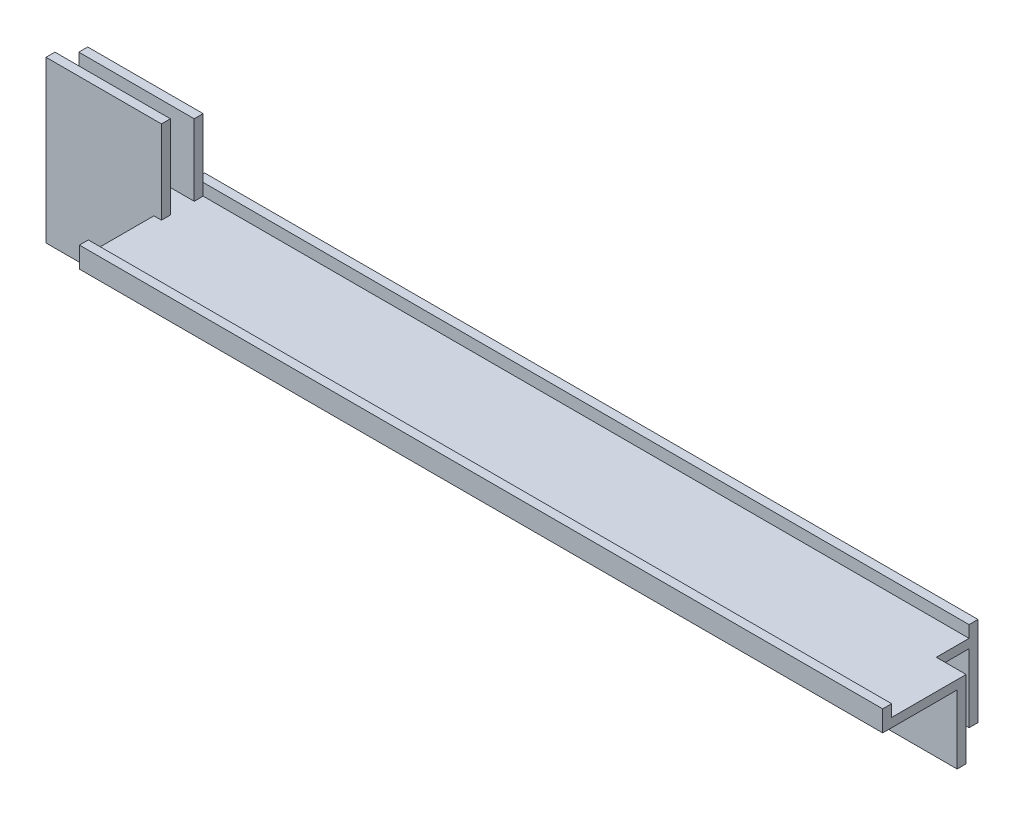
from build123d import *

# Parameters (mm, degrees)
SKETCH1_W                = 1.5
SKETCH1_H                = 2
BOSS_EXTRUDE1_DEPTH      = 259.69214
RIGHT_EAR_DEPTH          = 1.27
RIGHT_EAR_DEPTH_BACK     = 24.45893
SKETCH9_W                = 1.5
SKETCH9_H                = 11.5
LEFT_EAR_DEPTH           = 18.10893
LEFT_EAR_DEPTH_BACK      = 1.27
CUT_EXTRUDE6_DEPTH       = 280.89897194
CUT_EXTRUDE6_DEPTH_BACK  = 280.89897194
SURFACE_EXTRUDE1_1_BACK  = 307.34
SURFACE_EXTRUDE1_1_DEPTH = 308.93893
SURFACE_EXTRUDE1_2_BACK  = 307.34
SURFACE_EXTRUDE1_2_DEPTH = 308.93893
CUT_EXTRUDE7_DEPTH       = 157.732995968


with BuildPart() as part:
    # Sketch1 → Boss-Extrude1 (new body)
    with BuildSketch(Plane(origin=(0, 0, 0), x_dir=(0, 0, -1), z_dir=(1, 0, 0))):
        Polygon((-21, 0), (0, 0), (0, -13), (-1.5, -13), (-1.5, -1.5), (-7, -1.5), (-7, -13), (-8.5, -13), (-8.5, -1.5), (-21, -1.5), align=None)
        with Locations((-20.25, 1)):
            Rectangle(SKETCH1_W, SKETCH1_H)
        with Locations((-0.75, 1)):
            Rectangle(SKETCH1_W, SKETCH1_H)
    extrude(amount=-BOSS_EXTRUDE1_DEPTH)


with BuildPart() as body_2:
    # Mirror3: mirrored copy
    add(part.part.mirror(Plane.ZX.offset(7)))


with BuildPart() as part_1:
    add(part.part)

    add(body_2.part)  # right_ear merges body 2
    # Sketch9 → right_ear (add, two sides: drawn at the far end of the back side and taken through both)
    with BuildSketch(Plane.ZY.offset(-RIGHT_EAR_DEPTH_BACK)):
        with Locations((7.75, -7.25)):
            Rectangle(SKETCH9_W, SKETCH9_H)
        Polygon((1.5, -1.5), (7, -1.5), (8.5, -1.5), (8.5, 15.5), (7, 15.5), (1.5, 15.5), align=None)
        with Locations((7.75, 21.25)):
            Rectangle(SKETCH9_W, SKETCH9_H)
    extrude(amount=RIGHT_EAR_DEPTH + RIGHT_EAR_DEPTH_BACK)

    # Sketch12 → left_ear (add, two sides: drawn at the far end of the back side and taken through both)
    with BuildSketch(Plane.ZY.offset(259.69214).offset(-LEFT_EAR_DEPTH_BACK)):
        Polygon((8.5, -13), (8.5, 27), (7, 27), (7, 15.5), (1.5, 15.5), (1.5, -1.5), (7, -1.5), (7, -13), align=None)
    extrude(amount=LEFT_EAR_DEPTH + LEFT_EAR_DEPTH_BACK)

    # Sketch10<3> → Cut-Extrude6 (cut, two sides: drawn at the far end of the back side and taken through both)
    with BuildSketch(Plane(origin=(0, 0, 0), x_dir=(1, 0, 0), z_dir=(0, 1, 0)).offset(-CUT_EXTRUDE6_DEPTH_BACK)):
        Polygon((-1.27, -1.5), (-129.84607, -1.5), (-129.84607, -7), (-124.84607, -7), (-124.84607, -19.5), (0, -19.5), (0, -8.5), (-1.27, -8.5), align=None)
        Polygon((-129.84607, 5.228694749), (-129.84607, 0), (-129.84607, -1.5), (-1.27, -1.5), (-1.27, -8.5), (0, -8.5), (0, -19.5), (-124.84607, -19.5), (-124.84607, -21), (-124.84607, -30.387985995), (75.346094687, -30.387985995), (75.346094687, 5.228694749), align=None)
    extrude(amount=CUT_EXTRUDE6_DEPTH + CUT_EXTRUDE6_DEPTH_BACK, mode=Mode.SUBTRACT)


with BuildPart() as body_2_2:
    # L-Split2: the piece behind the surface
    add(part_1.part)
    # Surface-Extrude1: a surface, the sketch's curves swept straight by 308.93893 mm
    with BuildLine(Plane(origin=(24.45893, 0, 0), x_dir=(0, 0, -1), z_dir=(1, 0, 0)).offset(-SURFACE_EXTRUDE1_1_BACK), mode=Mode.PRIVATE) as surface_extrude1_1_path:
        Line((-19.5, 14), (-7, 14))
        Line((-7, 14), (-7, 0))
        Line((-7, 0), (-3, 0))
        Line((-3, 0), (-3, 12))
        Line((-3, 12), (0, 12))
    surface_extrude1_1 = Shell.extrude(surface_extrude1_1_path.wire(), (1 * SURFACE_EXTRUDE1_1_DEPTH, 0 * SURFACE_EXTRUDE1_1_DEPTH, 0 * SURFACE_EXTRUDE1_1_DEPTH))
    split(bisect_by=surface_extrude1_1, keep=Keep.BOTTOM)


with BuildPart() as part_2:
    add(part_1.part)

    # L-Split2: split by a surface, the side it looks to stays
    # Surface-Extrude1: a surface, the sketch's curves swept straight by 308.93893 mm
    with BuildLine(Plane(origin=(24.45893, 0, 0), x_dir=(0, 0, -1), z_dir=(1, 0, 0)).offset(-SURFACE_EXTRUDE1_2_BACK), mode=Mode.PRIVATE) as surface_extrude1_2_path:
        Line((-19.5, 14), (-7, 14))
        Line((-7, 14), (-7, 0))
        Line((-7, 0), (-3, 0))
        Line((-3, 0), (-3, 12))
        Line((-3, 12), (0, 12))
    surface_extrude1_2 = Shell.extrude(surface_extrude1_2_path.wire(), (1 * SURFACE_EXTRUDE1_2_DEPTH, 0 * SURFACE_EXTRUDE1_2_DEPTH, 0 * SURFACE_EXTRUDE1_2_DEPTH))
    split(bisect_by=surface_extrude1_2, keep=Keep.TOP)


with BuildPart() as cut_extrude7_tool:
    # Sketch14 → Cut-Extrude7 (new, through all)
    with BuildSketch(Plane.ZY.offset(277.80107)):
        Polygon((-4.726079356, 11.992451092), (3, 12), (3, 0), (7, 0), (7, 14), (19.5, 14), (19.5, 12), (27.004136279, 12), (27.004136279, 32.441536758), (-4.726079356, 32.441536758), align=None)
    extrude(amount=-CUT_EXTRUDE7_DEPTH)


with BuildPart() as part_3:
    add(part_2.part)

    # Cut-Extrude7: cut by cut_extrude7_tool
    add(cut_extrude7_tool.part, mode=Mode.SUBTRACT)


with BuildPart() as body_2_2_1:
    add(body_2_2.part)

    # Cut-Extrude7: cut by cut_extrude7_tool
    add(cut_extrude7_tool.part, mode=Mode.SUBTRACT)


solid = body_2_2_1.part
